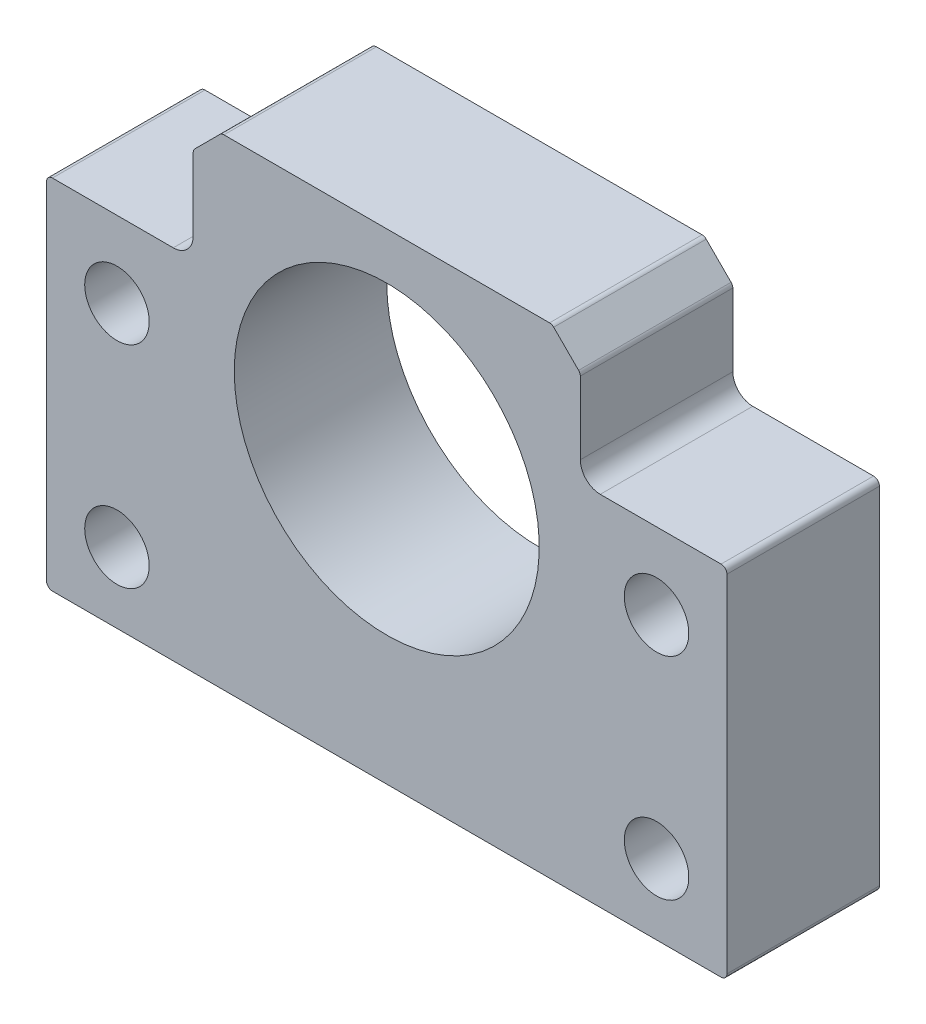
from build123d import *

# Parameters (mm, degrees)
SKETCH1_R           = 2.75
SKETCH1_R_2         = 13
BOSS_EXTRUDE1_DEPTH = 13
FILLET1_R           = 1.7
FILLET2_R           = 0.5


with BuildPart() as part:
    # Sketch1 → Boss-Extrude1 (new body)
    with BuildSketch(Plane.XY):
        Polygon((40.027969698, 14.696983914), (27.527969698, 14.696983914), (27.527969698, 22.782770351), (25.113756136, 25.196983914), (-3.057816739, 25.196983914), (-5.472030302, 22.782770351), (-5.472030302, 14.696983914), (-17.972030302, 14.696983914), (-17.972030302, -15.803016086), (40.027969698, -15.803016086), align=None)
        with Locations(Location((34.027969698, 8.196983914, 0), (0, 0, 180))):
            Circle(SKETCH1_R, mode=Mode.SUBTRACT)
        with Locations(Location((34.027969698, -9.803016086, 0), (0, 0, 180))):
            Circle(SKETCH1_R, mode=Mode.SUBTRACT)
        with Locations(Location((-11.972030302, -9.803016086, 0), (0, 0, 180))):
            Circle(SKETCH1_R, mode=Mode.SUBTRACT)
        with Locations(Location((-11.972030302, 8.196983914, 0), (0, 0, 180))):
            Circle(SKETCH1_R, mode=Mode.SUBTRACT)
        with Locations(Location((11.027969698, 8.196983914, 0), (0, 0, 180))):
            Circle(SKETCH1_R_2, mode=Mode.SUBTRACT)
    extrude(amount=BOSS_EXTRUDE1_DEPTH)

    # Fillet1
    fillet1_edges = [part.edges().sort_by_distance(p)[0] for p in [
        (-5.472030302, 14.696983914, 6.5),
        (27.527969698, 14.696983914, 6.5),
    ]]
    fillet(fillet1_edges, radius=FILLET1_R)

    # Fillet2
    fillet2_edges = [part.edges().sort_by_distance(p)[0] for p in [
        (40.027969698, -15.803016086, 6.5),
        (-17.972030302, -15.803016086, 6.5),
        (-17.972030302, 14.696983914, 6.5),
        (-5.472030302, 22.782770351, 6.5),
        (-3.057816739, 25.196983914, 6.5),
        (25.113756136, 25.196983914, 6.5),
        (27.527969698, 22.782770351, 6.5),
        (40.027969698, 14.696983914, 6.5),
    ]]
    fillet(fillet2_edges, radius=FILLET2_R)


solid = part.part
